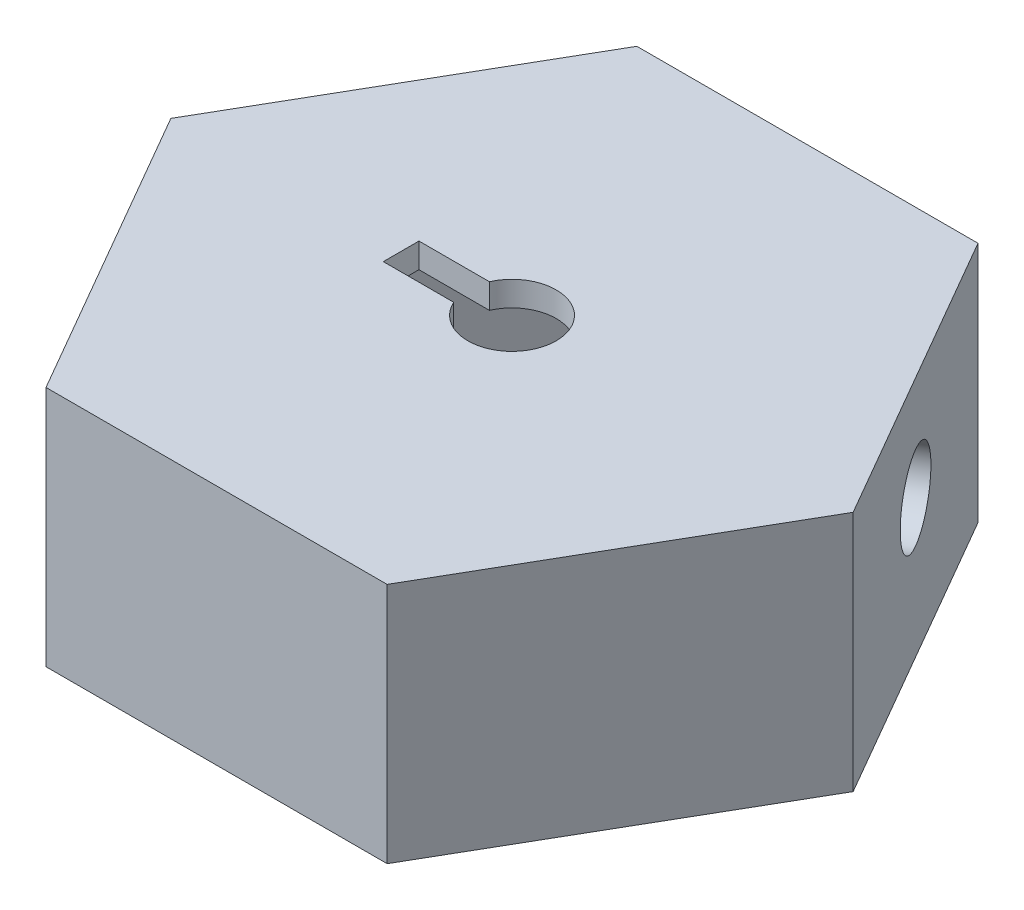
from build123d import *

# Parameters (mm, degrees)
BOSS_EXTRUDE1_DEPTH = 2.032
BOSS_EXTRUDE2_DEPTH = 17.78
CUT_EXTRUDE1_REACH  = 65.436
SKETCH4_R           = 3.429
CIRPATTERN1_COUNT   = 3
CIRPATTERN1_ANGLE   = 120


with BuildPart() as part:
    # Sketch1 → Boss-Extrude1 (new body)
    with BuildSketch(Plane(origin=(0, 0, 0), x_dir=(1, 0, 0), z_dir=(0, 1, 0))):
        Polygon((13.97, -24.196749782), (27.94, 0), (13.97, 24.196749782), (-13.97, 24.196749782), (-27.94, 0), (-13.97, -24.196749782), align=None)
        with BuildLine():
            Line((-9.0805, -1.4605), (-9.0805, 1.4605))
            Line((-9.0805, 1.4605), (-3.311754822, 1.4605))
            ThreePointArc((-3.311754822, 1.4605), (0.746285358, 3.541728168), (3.6195, 0))
            ThreePointArc((3.6195, 0), (0.746285358, -3.541728168), (-3.311754822, -1.4605))
            Line((-3.311754822, -1.4605), (-9.0805, -1.4605))
        make_face(mode=Mode.SUBTRACT)
    extrude(amount=BOSS_EXTRUDE1_DEPTH)

    # Sketch2 → Boss-Extrude2 (add)
    with BuildSketch(Plane.XZ):
        Polygon((13.97, 24.196749782), (-13.97, 24.196749782), (-27.94, 0), (-13.97, -24.196749782), (13.97, -24.196749782), (27.94, 0), align=None)
        Polygon((12.796824253, 22.164749782), (-12.796824253, 22.164749782), (-25.593648506, 0), (-12.796824253, -22.164749782), (12.796824253, -22.164749782), (25.593648506, 0), align=None, mode=Mode.SUBTRACT)
    extrude(amount=BOSS_EXTRUDE2_DEPTH)

    # Sketch4 → Cut-Extrude1 (cut, up to next)
    with BuildSketch(Plane(origin=(20.955, 0, -12.098374891), x_dir=(-0.49999999999999983, 0, -0.8660254037844387), z_dir=(0.8660254037844387, 0, -0.49999999999999983)), mode=Mode.PRIVATE) as cut_extrude1_sk1:
        with Locations((0, -6.477)):
            Circle(SKETCH4_R)
    cut_extrude1_tool1 = extrude(cut_extrude1_sk1.sketch, amount=-CUT_EXTRUDE1_REACH, mode=Mode.PRIVATE) & part.part
    cut_extrude1 = cut_extrude1_tool1.solids().sort_by_distance((20.955, -6.477, -12.098375))[0]
    add(cut_extrude1, mode=Mode.SUBTRACT)

    # CirPattern1: Cut-Extrude1 ×3 about axis
    cirpattern1_axis = Axis((0, 2.7686, 0), (0, 1, 0))
    for i in range(1, CIRPATTERN1_COUNT):
        add(cut_extrude1.rotate(cirpattern1_axis, i * CIRPATTERN1_ANGLE / (CIRPATTERN1_COUNT - 1)), mode=Mode.SUBTRACT)


solid = part.part
